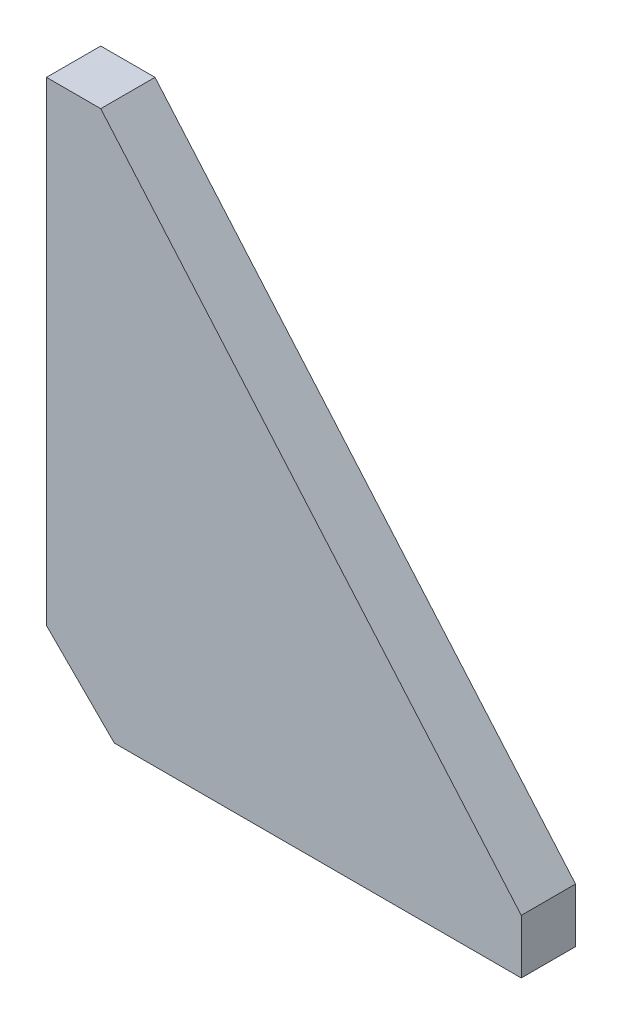
from build123d import *

# Parameters (mm, degrees)
EXTRUDE_1_DEPTH = 4
CHAMFER_1_SIZE  = 10


with BuildPart() as part:
    # Эскиз1 → Бобышка-Вытянуть1 (new, symmetric)
    with BuildSketch(Plane.XY):
        Polygon((0, 0), (0, 80), (8, 80), (70, 8), (70, 0), align=None)
    extrude(amount=EXTRUDE_1_DEPTH, both=True)

    # Фаска1
    chamfer_1_edges = [part.edges().sort_by_distance(p)[0] for p in [
        (0, 0, 0),
    ]]
    chamfer(chamfer_1_edges, length=CHAMFER_1_SIZE)


solid = part.part
